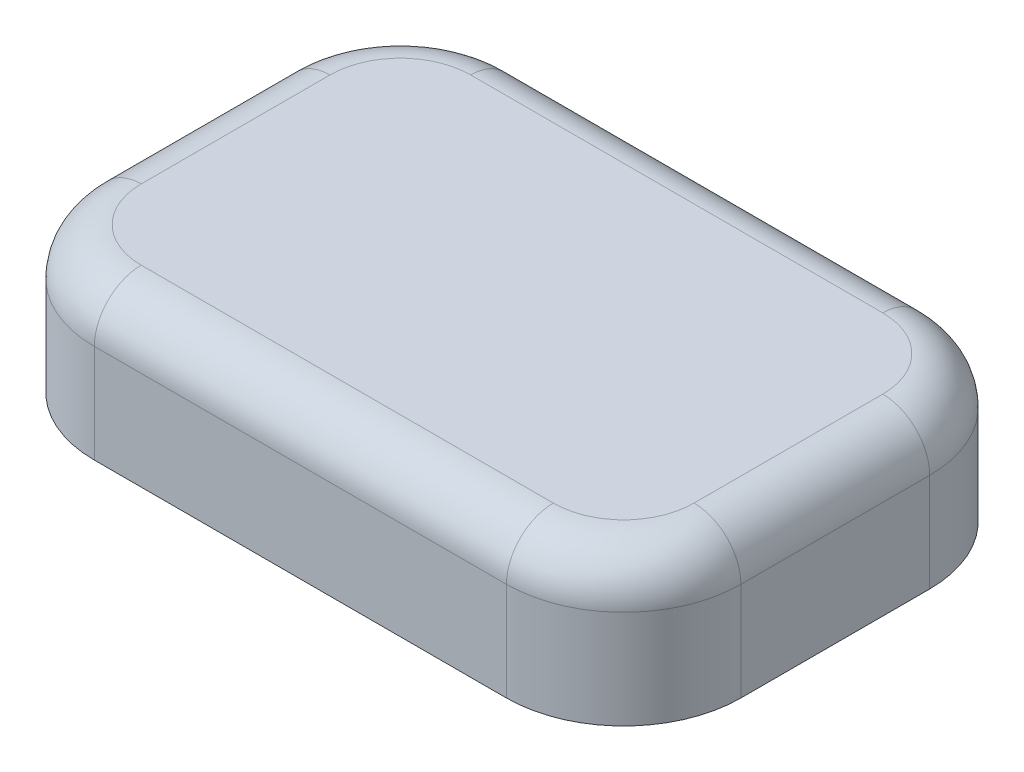
from build123d import *

# Parameters (mm, degrees)
SKETCH_1_R      = 2.8
EXTRUDE_1_DEPTH = 5
SKETCH_2_W      = 27.575
SKETCH_2_H      = 18.05
EXTRUDE_2_DEPTH = 1.2
SKETCH_3_W      = 27.575
SKETCH_3_H      = 18.05
SKETCH_3_W_2    = 25.175
SKETCH_3_H_2    = 15.65
EXTRUDE_3_DEPTH = 5
FILLET_1_R      = 5
FILLET_2_R      = 2
CHAMFER_1_SIZE  = 0.5


with BuildPart() as part:
    # 草图1 → 凸台-拉伸1 (new body)
    with BuildSketch(Plane(origin=(0, 0, 0), x_dir=(1, 0, 0), z_dir=(0, 1, 0))):
        with Locations(Location((0, 0, 0), (0, 0, 270))):
            Circle(SKETCH_1_R)
        Polygon((2.2, 0.6), (2.2, -0.6), (0.6, -0.6), (0.6, -2.2), (-0.6, -2.2), (-0.6, -0.6), (-2.2, -0.6), (-2.2, 0.6), (-0.6, 0.6), (-0.6, 2.2), (0.6, 2.2), (0.6, 0.6), align=None, mode=Mode.SUBTRACT)
    extrude(amount=-EXTRUDE_1_DEPTH)

    # 草图2 → 凸台-拉伸2 (add)
    with BuildSketch(Plane(origin=(0, 0, 0), x_dir=(1, 0, 0), z_dir=(0, 1, 0))):
        Rectangle(SKETCH_2_W, SKETCH_2_H)
    extrude(amount=EXTRUDE_2_DEPTH)

    # 草图3 → 凸台-拉伸3 (add)
    with BuildSketch(Plane(origin=(0, 0, 0), x_dir=(1, 0, 0), z_dir=(0, 1, 0))):
        Rectangle(SKETCH_3_W, SKETCH_3_H)
        Rectangle(SKETCH_3_W_2, SKETCH_3_H_2, mode=Mode.SUBTRACT)
    extrude(amount=-EXTRUDE_3_DEPTH)

    # 圆角1
    fillet_1_edges = [part.edges().sort_by_distance(p)[0] for p in [
        (13.7875, -1.9, 9.025),
        (13.7875, -1.9, -9.025),
        (-13.7875, -1.9, -9.025),
        (-13.7875, -1.9, 9.025),
        (-12.5875, -2.5, 7.825),
        (-12.5875, -2.5, -7.825),
        (12.5875, -2.5, -7.825),
        (12.5875, -2.5, 7.825),
    ]]
    fillet(fillet_1_edges, radius=FILLET_1_R)

    # 圆角2
    fillet_2_edges = [part.edges().sort_by_distance(p)[0] for p in [
        (-12.5875, 0, 0),
        (0, 0, 7.825),
        (0, 0, -7.825),
        (12.5875, 0, 0),
        (-11.123033906, 0, 6.360533906),
        (11.123033906, 0, 6.360533906),
        (11.123033906, 0, -6.360533906),
        (-11.123033906, 0, -6.360533906),
        (0, 1.2, -9.025),
        (13.7875, 1.2, 0),
        (-13.7875, 1.2, 0),
        (0, 1.2, 9.025),
        (-12.323033906, 1.2, -7.560533906),
        (-12.323033906, 1.2, 7.560533906),
        (12.323033906, 1.2, 7.560533906),
        (12.323033906, 1.2, -7.560533906),
    ]]
    fillet(fillet_2_edges, radius=FILLET_2_R)

    # 倒角1
    chamfer_1_edges = [part.edges().sort_by_distance(p)[0] for p in [
        (0, 0, -2.8),
    ]]
    chamfer(chamfer_1_edges, length=CHAMFER_1_SIZE)


solid = part.part
